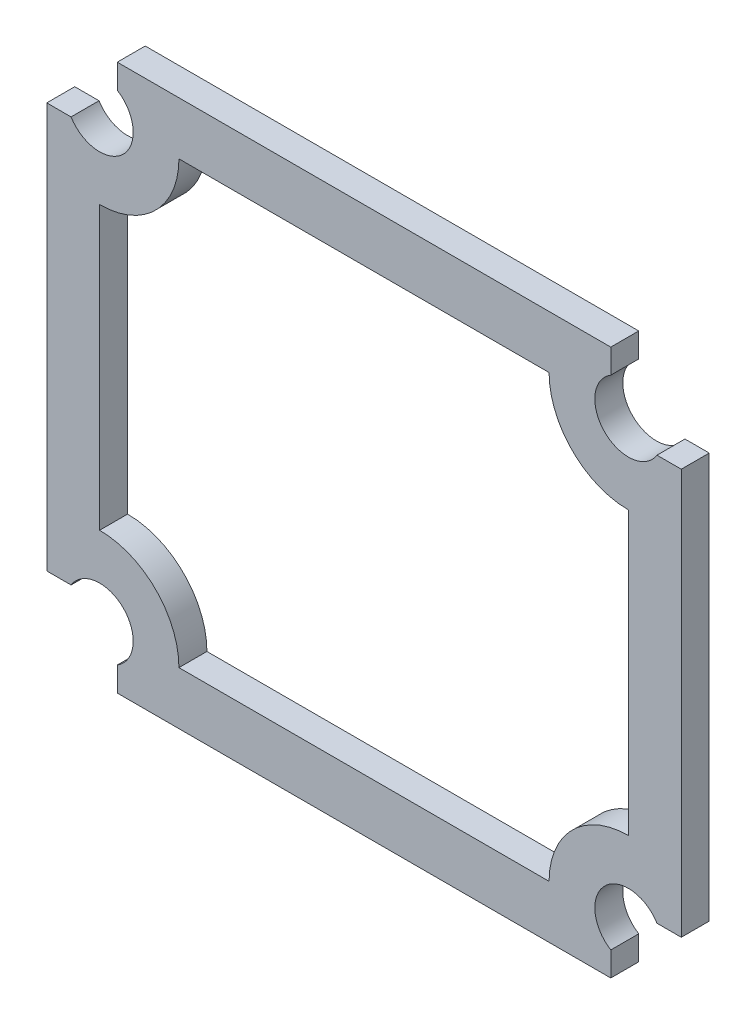
from build123d import *

# Parameters (mm, degrees)
BOSS_EXTRUDE1_DEPTH = 1.5875


with BuildPart() as part:
    # Sketch1 → Boss-Extrude1 (new body)
    with BuildSketch(Plane.XY):
        with BuildLine():
            Line((-18, 11.5), (-18, -11.5))
            Line((-18, -11.5), (-16.621426841, -11.5))
            ThreePointArc((-16.621426841, -11.5), (-13.652961582, -11.152961582), (-14, -14.121426841))
            Line((-14, -14.121426841), (-14, -15.5))
            Line((-14, -15.5), (14, -15.5))
            Line((14, -15.5), (14, -14.121426841))
            ThreePointArc((14, -14.121426841), (13.652961582, -11.152961582), (16.621426841, -11.5))
            Line((16.621426841, -11.5), (18, -11.5))
            Line((18, -11.5), (18, 11.5))
            Line((18, 11.5), (16.621426841, 11.5))
            ThreePointArc((16.621426841, 11.5), (13.652961582, 11.152961582), (14, 14.121426841))
            Line((14, 14.121426841), (14, 15.5))
            Line((14, 15.5), (-14, 15.5))
            Line((-14, 15.5), (-14, 14.121426841))
            ThreePointArc((-14, 14.121426841), (-13.652961582, 11.152961582), (-16.621426841, 11.5))
            Line((-16.621426841, 11.5), (-18, 11.5))
        make_face()
        with BuildLine():
            Line((-15, 8), (-15, -8))
            ThreePointArc((-15, -8), (-11.818019485, -9.318019485), (-10.5, -12.5))
            Line((-10.5, -12.5), (10.5, -12.5))
            ThreePointArc((10.5, -12.5), (11.818019485, -9.318019485), (15, -8))
            Line((15, -8), (15, 8))
            ThreePointArc((15, 8), (11.818019485, 9.318019485), (10.5, 12.5))
            Line((10.5, 12.5), (-10.5, 12.5))
            ThreePointArc((-10.5, 12.5), (-11.818019485, 9.318019485), (-15, 8))
        make_face(mode=Mode.SUBTRACT)
    extrude(amount=BOSS_EXTRUDE1_DEPTH)


solid = part.part
